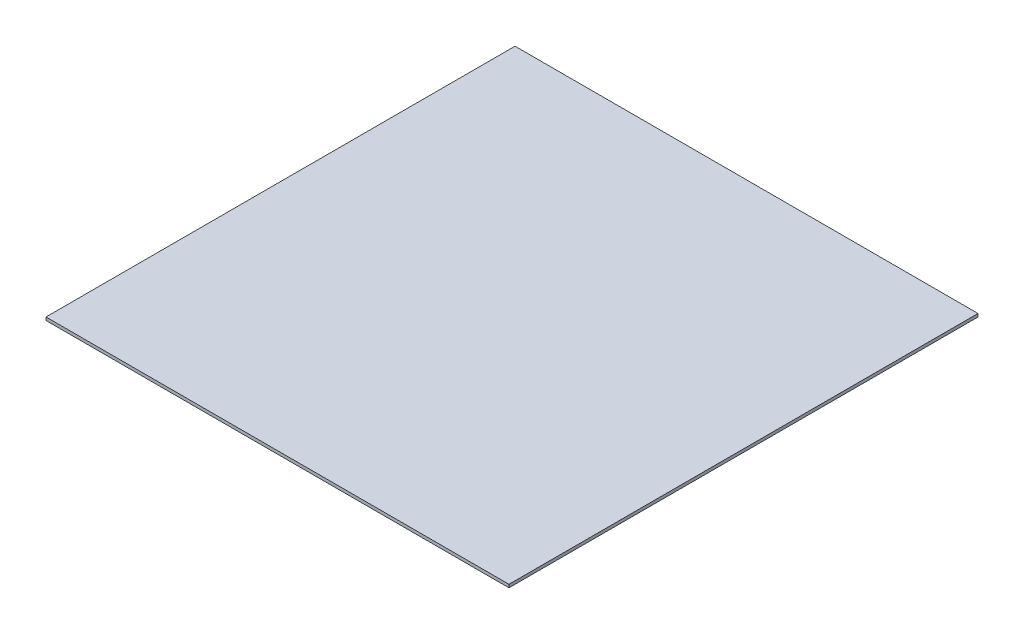
from build123d import *

# Parameters (mm, degrees)
SKETCH1_W           = 451.3
SKETCH1_H           = 457.2
BOSS_EXTRUDE1_DEPTH = 3


with BuildPart() as part:
    # Sketch1 → Boss-Extrude1 (new body)
    with BuildSketch(Plane(origin=(0, 0, 0), x_dir=(1, 0, 0), z_dir=(0, 1, 0))):
        Rectangle(SKETCH1_W, SKETCH1_H)
    extrude(amount=BOSS_EXTRUDE1_DEPTH)


solid = part.part
